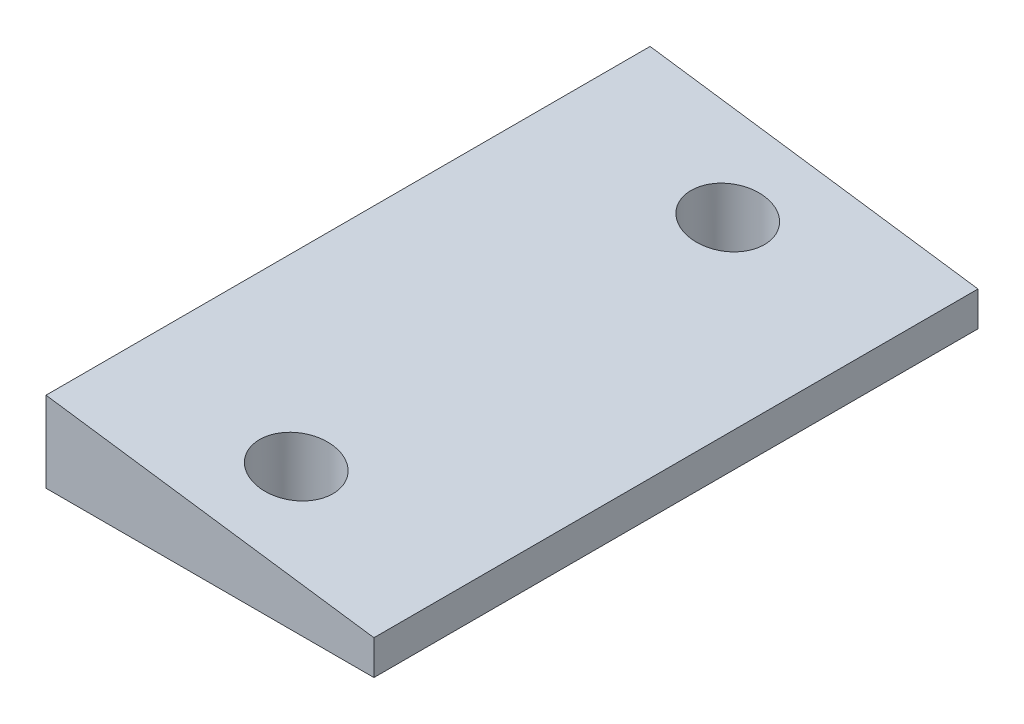
from build123d import *

# Parameters (mm, degrees)
DODANIE_WYCI_GNI_CIE1_DEPTH = 70
SZKIC2_R                    = 4.25
WYTNIJ_WYCI_GNI_CIE1_DEPTH  = 10


with BuildPart() as part:
    # Szkic1 → Dodanie-wyciągnięcie1 (new body)
    with BuildSketch(Plane.XY):
        Polygon((-16.558198873, 5.237130444), (-16.558198873, -4.103421275), (21.441801127, -4.103421275), (21.441801127, -0.103421275), align=None)
    extrude(amount=DODANIE_WYCI_GNI_CIE1_DEPTH)

    # Szkic2 → Wytnij-wyciągnięcie1 (cut)
    with BuildSketch(Plane(origin=(0, 5.237130444, 0), x_dir=(-1, 0, 0), z_dir=(0, -1, 0))):
        with Locations(Location((-2.441801127, -60, 0), (0, 0, 270))):
            Circle(SZKIC2_R)
        with Locations(Location((-2.441801127, -10, 0), (0, 0, 270))):
            Circle(SZKIC2_R)
    extrude(amount=WYTNIJ_WYCI_GNI_CIE1_DEPTH, mode=Mode.SUBTRACT)


solid = part.part
